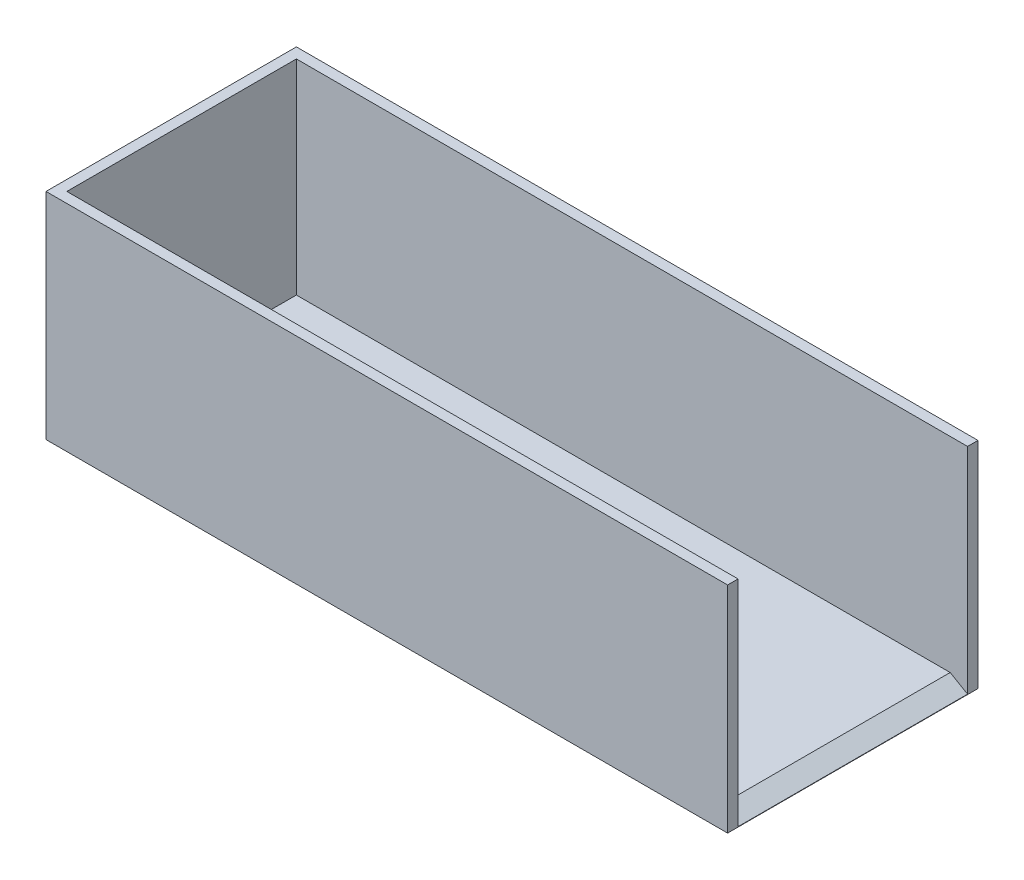
from build123d import *

# Parameters (mm, degrees)
ESQUISSE1_W        = 196
ESQUISSE1_H        = 72
BOSS_EXTRU_1_DEPTH = 3
BOSS_EXTRU_2_DEPTH = 58.8
CHANFREIN1_SIZE    = 2.886751346
CHANFREIN1_SIZE2   = 5


with BuildPart() as part:
    # Esquisse1 → Boss.-Extru.1 (new body)
    with BuildSketch(Plane(origin=(0, 0, 0), x_dir=(1, 0, 0), z_dir=(0, 1, 0))):
        with Locations((60.813158837, -17.029685758)):
            Rectangle(ESQUISSE1_W, ESQUISSE1_H)
    extrude(amount=BOSS_EXTRU_1_DEPTH)

    # Esquisse2 → Boss.-Extru.2 (add)
    with BuildSketch(Plane(origin=(0, 3, 0), x_dir=(1, 0, 0), z_dir=(0, 1, 0))):
        Polygon((-37.186841163, 18.970314242), (158.813158837, 18.970314242), (158.813158837, 15.970314242), (-34.186841163, 15.970314242), (-34.186841163, -50.029685758), (158.813158837, -50.029685758), (158.813158837, -53.029685758), (-37.186841163, -53.029685758), align=None)
    extrude(amount=BOSS_EXTRU_2_DEPTH)

    # Chanfrein1
    chanfrein1_edges = [part.edges().sort_by_distance(p)[0] for p in [
        (158.813158837, 3, 17.029685758),
    ]]
    chanfrein1_side = [part.faces().sort_by_distance(p)[0] for p in [
        (158.813158837, 30.9, -18.021460196),
    ]]
    chamfer(chanfrein1_edges, length=CHANFREIN1_SIZE, length2=CHANFREIN1_SIZE2, reference=chanfrein1_side[0])


solid = part.part
